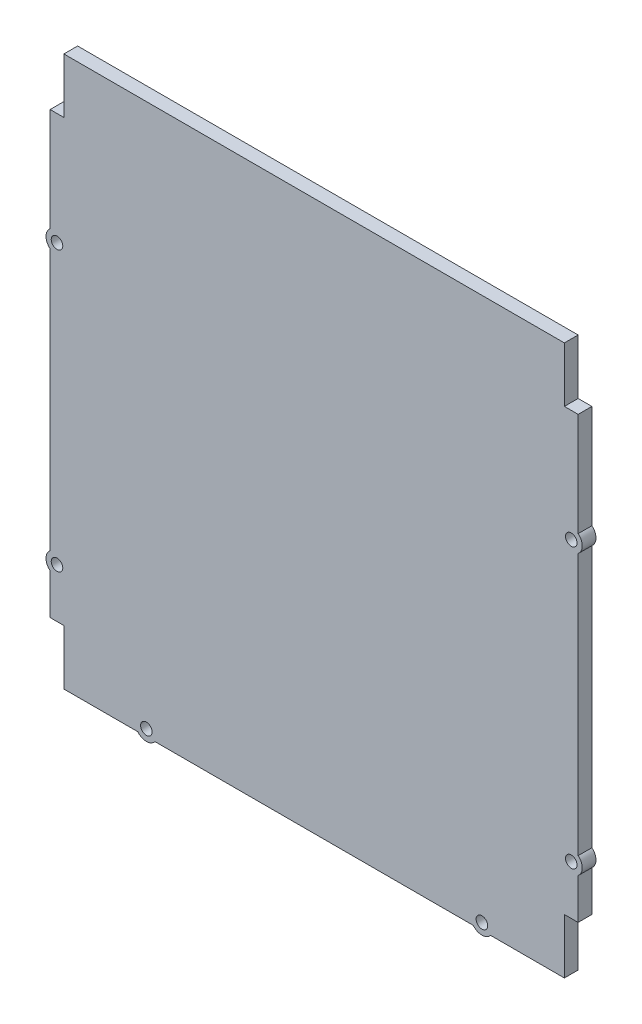
from build123d import *

# Parameters (mm, degrees)
BOSS_EXTRUDE1_DEPTH = 5
SKETCH2_R           = 2.1
CUT_EXTRUDE1_DEPTH  = 10
BOSS_EXTRUDE2_DEPTH = 5
BOSS_EXTRUDE3_DEPTH = 5
SKETCH5_R           = 2.1
CUT_EXTRUDE2_DEPTH  = 5
BOSS_EXTRUDE4_DEPTH = 5


with BuildPart() as part:
    # Sketch1 → Boss-Extrude1 (new body)
    with BuildSketch(Plane.XY):
        Polygon((-182, 200), (-182, 180), (-187, 180), (-187, 20), (-182, 20), (-182, 0), (0, 0), (0, 20), (5, 20), (5, 180), (0, 180), (0, 200), align=None)
    extrude(amount=BOSS_EXTRUDE1_DEPTH)

    # Sketch2 → Cut-Extrude1 (cut)
    with BuildSketch(Plane(origin=(0, 0, 0), x_dir=(-1, 0, 0), z_dir=(0, 0, -1))):
        with Locations((-2.5, 139.3)):
            Circle(SKETCH2_R)
        with Locations((-2.5, 37.9)):
            Circle(SKETCH2_R)
        with Locations(Location((184.5, 37.9, 0), (0, 0, 180))):
            Circle(SKETCH2_R)
        with Locations(Location((184.5, 139.3, 0), (0, 0, 180))):
            Circle(SKETCH2_R)
    extrude(amount=-CUT_EXTRUDE1_DEPTH, mode=Mode.SUBTRACT)

    # Sketch3 → Boss-Extrude2 (add)
    with BuildSketch(Plane(origin=(0, 0, 0), x_dir=(-1, 0, 0), z_dir=(0, 0, -1))):
        with BuildLine():
            Line((-5, 136.177501001), (-5, 142.422498999))
            ThreePointArc((-5, 142.422498999), (-6.5, 139.3), (-5, 136.177501001))
        make_face()
    boss_extrude2 = extrude(amount=-BOSS_EXTRUDE2_DEPTH)

    # Sketch4 → Boss-Extrude3 (add)
    with BuildSketch(Plane(origin=(0, 0, 0), x_dir=(-1, 0, 0), z_dir=(0, 0, -1))):
        with BuildLine():
            Line((-5, 34.777501001), (-5, 41.022498999))
            ThreePointArc((-5, 41.022498999), (-6.5, 37.9), (-5, 34.777501001))
        make_face()
    boss_extrude3 = extrude(amount=-BOSS_EXTRUDE3_DEPTH)

    # Mirror1: Boss-Extrude2, Boss-Extrude3 across plane
    add(boss_extrude2.mirror(Plane.ZY.offset(91)))
    add(boss_extrude3.mirror(Plane.ZY.offset(91)))

    # Sketch5 → Cut-Extrude2 (cut)
    with BuildSketch(Plane(origin=(0, 0, 0), x_dir=(-1, 0, 0), z_dir=(0, 0, -1))):
        with Locations((30, 2.5)):
            Circle(SKETCH5_R)
        with Locations((152, 2.5)):
            Circle(SKETCH5_R)
    extrude(amount=-CUT_EXTRUDE2_DEPTH, mode=Mode.SUBTRACT)

    # Sketch6 → Boss-Extrude4 (add)
    with BuildSketch(Plane(origin=(0, 0, 0), x_dir=(-1, 0, 0), z_dir=(0, 0, -1))):
        with BuildLine():
            Line((155.122498999, 0), (148.877501001, 0))
            ThreePointArc((148.877501001, 0), (152, -1.5), (155.122498999, 0))
        make_face()
        with BuildLine():
            Line((33.122498999, 0), (26.877501001, 0))
            ThreePointArc((26.877501001, 0), (30, -1.5), (33.122498999, 0))
        make_face()
    extrude(amount=-BOSS_EXTRUDE4_DEPTH)


solid = part.part
